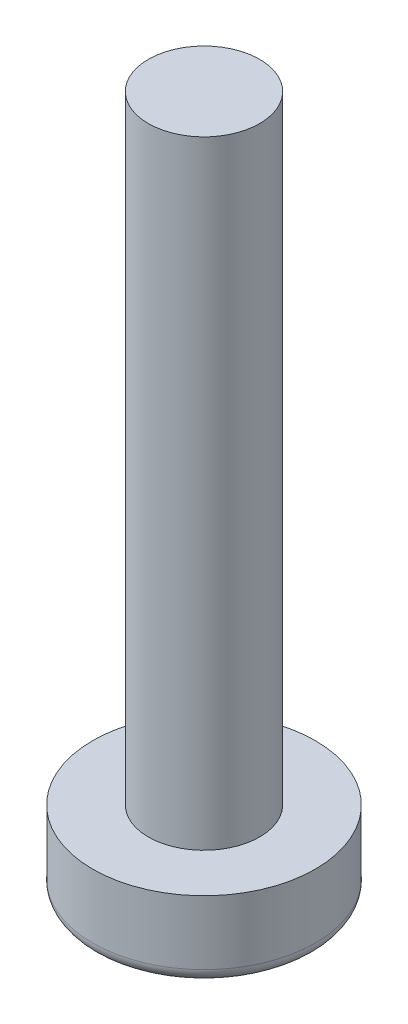
from build123d import *

# Parameters (mm, degrees)
SKETCH_1_R      = 4
EXTRUDE_1_DEPTH = 2.8
SKETCH_1_3_R    = 2
EXTRUDE_2_DEPTH = 25
FILLET_1_R      = 0.5


with BuildPart() as part:
    # 草图1 → 凸台-拉伸1 (new body)
    with BuildSketch(Plane(origin=(0, 0, 0), x_dir=(1, 0, 0), z_dir=(0, 1, 0))):
        Circle(SKETCH_1_R)
    extrude(amount=EXTRUDE_1_DEPTH)

    # 草图1<3> → 凸台-拉伸2 (add)
    with BuildSketch(Plane(origin=(0, 0, 0), x_dir=(1, 0, 0), z_dir=(0, 1, 0))):
        Circle(SKETCH_1_3_R)
    extrude(amount=EXTRUDE_2_DEPTH)

    # 圆角1
    fillet_1_edges = [part.edges().sort_by_distance(p)[0] for p in [
        (-4, 0, 0),
    ]]
    fillet(fillet_1_edges, radius=FILLET_1_R)


solid = part.part
